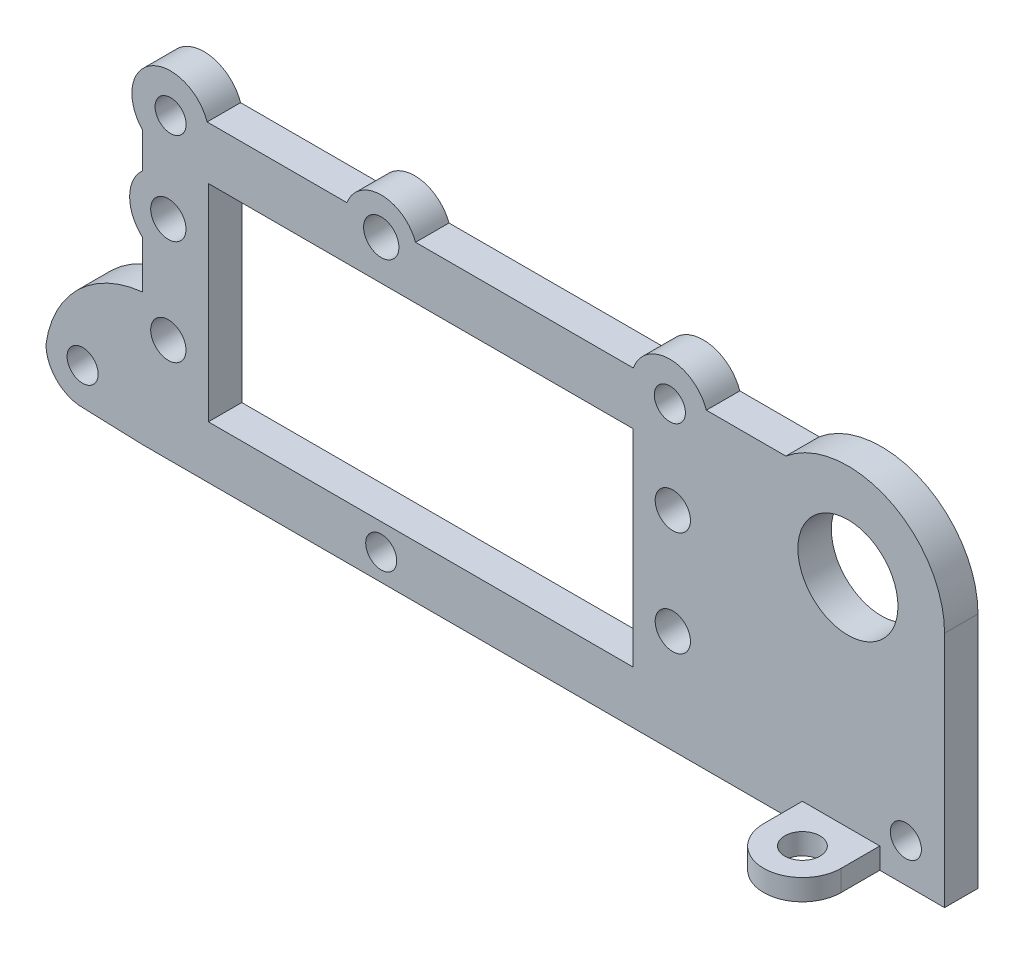
from build123d import *

# Parameters (mm, degrees)
SKETCH1_W            = 6.266
SKETCH1_H            = 19.6
SKETCH1_R            = 1.675
SKETCH1_W_2          = 52.832
SKETCH1_H_2          = 5
BOSS_EXTRUDE2_DEPTH  = 3.175
SKETCH3_W            = 30
SKETCH3_H            = 29.6
BOSS_EXTRUDE3_DEPTH  = 3.175
SKETCH4_R            = 4.75
CUT_EXTRUDE1_DEPTH   = 10
BOSS_EXTRUDE14_DEPTH = 3.175
CUT_EXTRUDE8_DEPTH   = 10
SKETCH24_R           = 1.475
CUT_EXTRUDE9_DEPTH   = 10
SKETCH25_R           = 3.675
SKETCH25_R_2         = 1.675
BOSS_EXTRUDE15_DEPTH = 3.175
SKETCH26_R           = 1.475
CUT_EXTRUDE12_DEPTH  = 3.175
CUT_EXTRUDE13_DEPTH  = 10
SKETCH28_R           = 3.675
SKETCH28_R_2         = 1.675
BOSS_EXTRUDE16_DEPTH = 3.175
SKETCH29_R           = 1.475
BOSS_EXTRUDE17_DEPTH = 3.175
BOSS_EXTRUDE19_DEPTH = 3.175
SKETCH32_R           = 1.675
CUT_EXTRUDE14_DEPTH  = 53.757206626
CUT_EXTRUDE15_DEPTH  = 53.757206626
BOSS_EXTRUDE20_START = -3.175
SKETCH34_R           = 2.202287172
SKETCH34_R_2         = 1.475
SKETCH34_R_3         = 2.310224014
BOSS_EXTRUDE20_DEPTH = 3.175
SKETCH30_R           = 3.675
SKETCH30_R_2         = 1.675
BOSS_EXTRUDE18_DEPTH = 2


with BuildPart() as part:
    # Sketch1 → Boss-Extrude2 (new body)
    # profile 1 of 4: a face of its own
    with BuildSketch(Plane.XY):
        with Locations((-23.283, 0)):
            Rectangle(SKETCH1_W, SKETCH1_H)
        with Locations((-23.95, -4.974)):
            Circle(SKETCH1_R, mode=Mode.SUBTRACT)
        with Locations((-23.95, 4.974)):
            Circle(SKETCH1_R, mode=Mode.SUBTRACT)
    # profile 2 of 4: a face of its own
    with BuildSketch(Plane.XY):
        with Locations((0, -12.3)):
            Rectangle(SKETCH1_W_2, SKETCH1_H_2)
    # profile 3 of 4: a face of its own
    with BuildSketch(Plane.XY):
        with Locations((0, 12.3)):
            Rectangle(SKETCH1_W_2, SKETCH1_H_2)
    # profile 4 of 4: a face of its own
    with BuildSketch(Plane.XY):
        with Locations((23.283, 0)):
            Rectangle(SKETCH1_W, SKETCH1_H)
        with Locations((23.95, -4.974)):
            Circle(SKETCH1_R, mode=Mode.SUBTRACT)
        with Locations((23.95, 4.974)):
            Circle(SKETCH1_R, mode=Mode.SUBTRACT)
    extrude(amount=BOSS_EXTRUDE2_DEPTH)

    # Sketch3 → Boss-Extrude3 (add)
    with BuildSketch(Plane.XY.offset(3.175)):
        with Locations((41.416, 0)):
            Rectangle(SKETCH3_W, SKETCH3_H)
    extrude(amount=-BOSS_EXTRUDE3_DEPTH)

    # Sketch4 → Cut-Extrude1 (cut)
    with BuildSketch(Plane(origin=(0, 0, 0), x_dir=(-1, 0, 0), z_dir=(0, 0, -1))):
        with Locations((-40.576, 7.77)):
            Circle(SKETCH4_R)
    extrude(amount=-CUT_EXTRUDE1_DEPTH, mode=Mode.SUBTRACT)

    # Sketch22 → Boss-Extrude14 (add)
    with BuildSketch(Plane(origin=(0, 0, 0), x_dir=(-1, 0, 0), z_dir=(0, 0, -1))):
        with BuildLine():
            ThreePointArc((-34.680262133, 14.8), (-40.576, 16.945), (-46.471737867, 14.8))
            Line((-46.471737867, 14.8), (-34.680262133, 14.8))
        make_face()
    extrude(amount=-BOSS_EXTRUDE14_DEPTH)

    # Sketch23 → Cut-Extrude8 (cut)
    with BuildSketch(Plane(origin=(0, 0, 0), x_dir=(-1, 0, 0), z_dir=(0, 0, -1))):
        with BuildLine():
            Line((-49.751, -14.8), (-49.751, 7.77))
            ThreePointArc((-49.751, 7.77), (-48.890866804, 11.648609936), (-46.471737867, 14.8))
            Line((-46.471737867, 14.8), (-56.416, 14.8))
            Line((-56.416, 14.8), (-56.416, -14.8))
            Line((-56.416, -14.8), (-49.751, -14.8))
        make_face()
    extrude(amount=-CUT_EXTRUDE8_DEPTH, mode=Mode.SUBTRACT)

    # Sketch24 → Cut-Extrude9 (cut)
    with BuildSketch(Plane(origin=(0, 0, 0), x_dir=(-1, 0, 0), z_dir=(0, 0, -1))):
        with Locations((23.736, 13.59)):
            Circle(SKETCH24_R)
    extrude(amount=-CUT_EXTRUDE9_DEPTH, mode=Mode.SUBTRACT)

    # Sketch25 → Boss-Extrude15 (add)
    # profile 1 of 3: a face of its own
    with BuildSketch(Plane(origin=(0, 0, 0), x_dir=(-1, 0, 0), z_dir=(0, 0, -1))):
        with Locations((23.95, -4.974)):
            Circle(SKETCH25_R)
        with Locations(Location((23.95, -4.974, 0), (0, 0, 180))):
            Circle(SKETCH25_R_2, mode=Mode.SUBTRACT)
    # profile 2 of 3: a face of its own
    with BuildSketch(Plane(origin=(0, 0, 0), x_dir=(-1, 0, 0), z_dir=(0, 0, -1))):
        with Locations((23.95, 4.974)):
            Circle(SKETCH25_R)
        with Locations(Location((23.95, 4.974, 0), (0, 0, 180))):
            Circle(SKETCH25_R_2, mode=Mode.SUBTRACT)
    # profile 3 of 3: a face of its own
    with BuildSketch(Plane(origin=(0, 0, 0), x_dir=(-1, 0, 0), z_dir=(0, 0, -1))):
        with Locations((23.736, 13.59)):
            Circle(SKETCH25_R)
        with Locations((23.736, 13.59)):
            Circle(SKETCH25_R_2, mode=Mode.SUBTRACT)
    extrude(amount=-BOSS_EXTRUDE15_DEPTH)

    # Sketch26 → Cut-Extrude12 (cut)
    with BuildSketch(Plane(origin=(0, 0, 0), x_dir=(-1, 0, 0), z_dir=(0, 0, -1))):
        with Locations((-46.076, -11.125)):
            Circle(SKETCH26_R)
    extrude(amount=-CUT_EXTRUDE12_DEPTH, mode=Mode.SUBTRACT)

    # Sketch27 → Cut-Extrude13 (cut)
    with BuildSketch(Plane(origin=(0, 0, 0), x_dir=(-1, 0, 0), z_dir=(0, 0, -1))):
        with BuildLine():
            ThreePointArc((-22.190754209, 13.59), (-22.358119678, 14.272434563), (-22.822234796, 14.8))
            Line((-22.822234796, 14.8), (-24.509273622, 14.8))
            ThreePointArc((-24.509273622, 14.8), (-24.348188772, 12.282365469), (-22.190754209, 13.59))
        make_face()
        with BuildLine():
            Line((-24.509273622, 14.8), (-22.822234796, 14.8))
            ThreePointArc((-22.822234796, 14.8), (-23.665754209, 15.065), (-24.509273622, 14.8))
        make_face()
    extrude(amount=-CUT_EXTRUDE13_DEPTH, mode=Mode.SUBTRACT)

    # Sketch28 → Boss-Extrude16 (add)
    with BuildSketch(Plane(origin=(0, 0, 0), x_dir=(-1, 0, 0), z_dir=(0, 0, -1))):
        with Locations((-23.665754209, 13.59)):
            Circle(SKETCH28_R)
        with Locations((-23.665754209, 13.59)):
            Circle(SKETCH28_R_2, mode=Mode.SUBTRACT)
    extrude(amount=-BOSS_EXTRUDE16_DEPTH)

    # Sketch29 → Boss-Extrude17 (add)
    with BuildSketch(Plane(origin=(0, 0, 0), x_dir=(-1, 0, 0), z_dir=(0, 0, -1))):
        with BuildLine():
            ThreePointArc((35.566, -11.125), (32.517318638, -5.113632727), (26.416, -2.249212118))
            Line((26.416, -2.249212118), (26.416, -14.8))
            Line((26.416, -14.8), (32.091, -14.6))
            ThreePointArc((32.091, -14.6), (34.548196065, -13.582196065), (35.566, -11.125))
        make_face()
        with Locations((32.091, -11.125)):
            Circle(SKETCH29_R, mode=Mode.SUBTRACT)
    extrude(amount=-BOSS_EXTRUDE17_DEPTH)

    # Sketch31 → Boss-Extrude19 (add)
    with BuildSketch(Plane(origin=(0, 0, 0), x_dir=(-1, 0, 0), z_dir=(0, 0, -1))):
        with BuildLine():
            ThreePointArc((4.579519413, 14.8), (5.043634531, 14.272434563), (5.211, 13.59))
            ThreePointArc((5.211, 13.59), (3.053565437, 12.282365469), (2.892480587, 14.8))
            Line((2.892480587, 14.8), (0.478466424, 14.8))
            ThreePointArc((0.478466424, 14.8), (3.121306653, 10.169798677), (7.211, 13.59))
            ThreePointArc((7.211, 13.59), (7.156201323, 14.204693347), (6.993533576, 14.8))
            Line((6.993533576, 14.8), (4.579519413, 14.8))
        make_face()
        with BuildLine():
            ThreePointArc((2.892480587, 14.8), (3.736, 15.065), (4.579519413, 14.8))
            Line((4.579519413, 14.8), (6.993533576, 14.8))
            ThreePointArc((6.993533576, 14.8), (3.736, 17.065), (0.478466424, 14.8))
            Line((0.478466424, 14.8), (2.892480587, 14.8))
        make_face()
    extrude(amount=-BOSS_EXTRUDE19_DEPTH)

    # Sketch32 → Cut-Extrude14 (cut, through all)
    with BuildSketch(Plane(origin=(0, 0, 0), x_dir=(-1, 0, 0), z_dir=(0, 0, -1))):
        with Locations((3.736, 13.59)):
            Circle(SKETCH32_R)
    extrude(amount=-CUT_EXTRUDE14_DEPTH, mode=Mode.SUBTRACT)

    # Sketch33 → Cut-Extrude15 (cut, through all)
    with BuildSketch(Plane(origin=(0, 0, 0), x_dir=(-1, 0, 0), z_dir=(0, 0, -1))):
        with BuildLine():
            ThreePointArc((5.211, -12.3), (4.778982502, -11.257017498), (3.736, -10.825))
            Line((3.736, -10.825), (3.736, -13.775))
            ThreePointArc((3.736, -13.775), (4.778982502, -13.342982502), (5.211, -12.3))
        make_face()
        with BuildLine():
            Line((3.736, -13.775), (3.736, -10.825))
            ThreePointArc((3.736, -10.825), (2.261, -12.3), (3.736, -13.775))
        make_face()
    extrude(amount=-CUT_EXTRUDE15_DEPTH, mode=Mode.SUBTRACT)

    # Sketch34 → Boss-Extrude20 (add)
    # profile 1 of 2: a face of its own
    with BuildSketch(Plane.XY.offset(3.175).offset(BOSS_EXTRUDE20_START)):
        with Locations((-23.736, 13.59)):
            Circle(SKETCH34_R)
        with Locations(Location((-23.736, 13.59, 0), (0, 0, 180))):
            Circle(SKETCH34_R_2, mode=Mode.SUBTRACT)
    # profile 2 of 2: a face of its own
    with BuildSketch(Plane.XY.offset(3.175).offset(BOSS_EXTRUDE20_START)):
        with Locations((23.665754209, 13.59)):
            Circle(SKETCH34_R_3)
        with Locations(Location((23.665754209, 13.59, 0), (0, 0, 180))):
            Circle(SKETCH34_R_2, mode=Mode.SUBTRACT)
    extrude(amount=BOSS_EXTRUDE20_DEPTH)


with BuildPart() as body_2:
    # Sketch30 → Boss-Extrude18 (new body)
    # profile 1 of 3: a face of its own
    with BuildSketch(Plane(origin=(0, -14.8, 0), x_dir=(-1, 0, 0), z_dir=(0, -1, 0))):
        with Locations((-39.926, -6.85)):
            Circle(SKETCH30_R)
        with Locations(Location((-39.926, -6.85, 0), (0, 0, 180))):
            Circle(SKETCH30_R_2, mode=Mode.SUBTRACT)
    # profile 2 of 3: a face of its own
    with BuildSketch(Plane(origin=(0, -14.8, 0), x_dir=(-1, 0, 0), z_dir=(0, -1, 0))):
        with BuildLine():
            Line((-43.601, -3.175), (-43.601, -6.85))
            ThreePointArc((-43.601, -6.85), (-42.524617421, -4.251382579), (-39.926, -3.175))
            Line((-39.926, -3.175), (-43.601, -3.175))
        make_face()
    # profile 3 of 3: a face of its own
    with BuildSketch(Plane(origin=(0, -14.8, 0), x_dir=(-1, 0, 0), z_dir=(0, -1, 0))):
        with BuildLine():
            ThreePointArc((-39.926, -3.175), (-37.327382579, -4.251382579), (-36.251, -6.85))
            Line((-36.251, -6.85), (-36.251, -3.175))
            Line((-36.251, -3.175), (-39.926, -3.175))
        make_face()
    extrude(amount=-BOSS_EXTRUDE18_DEPTH)


solid = Compound([part.part, body_2.part])
